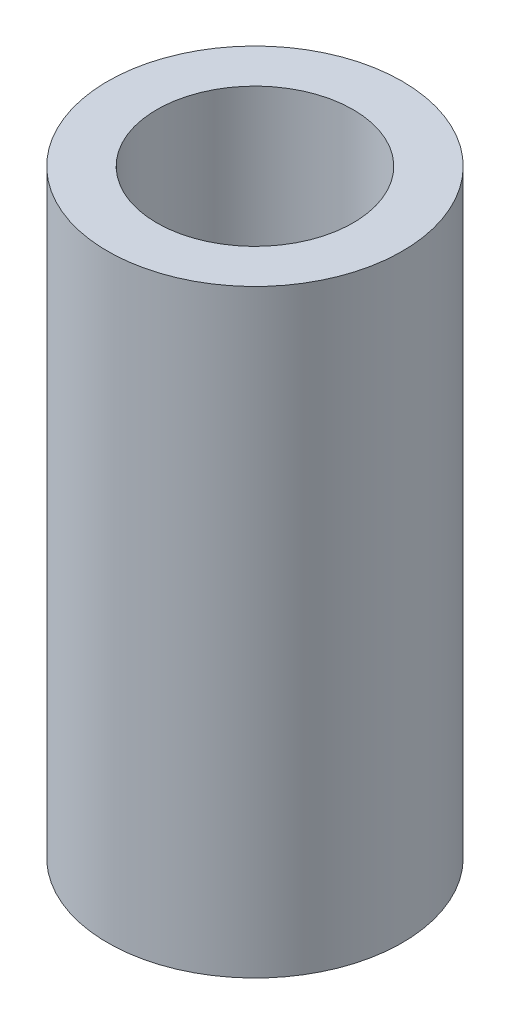
from build123d import *

# Parameters (mm, degrees)
SKETCH_1_R      = 7.5
SKETCH_1_R_2    = 5
EXTRUDE_1_DEPTH = 30.5


with BuildPart() as part:
    # 草图1 → 凸台-拉伸1 (new body)
    with BuildSketch(Plane(origin=(0, 0, 0), x_dir=(1, 0, 0), z_dir=(0, 1, 0))):
        with Locations(Location((0, 0, 0), (0, 0, 90))):
            Circle(SKETCH_1_R)
        with Locations(Location((0, 0, 0), (0, 0, 90))):
            Circle(SKETCH_1_R_2, mode=Mode.SUBTRACT)
    extrude(amount=EXTRUDE_1_DEPTH)


solid = part.part
